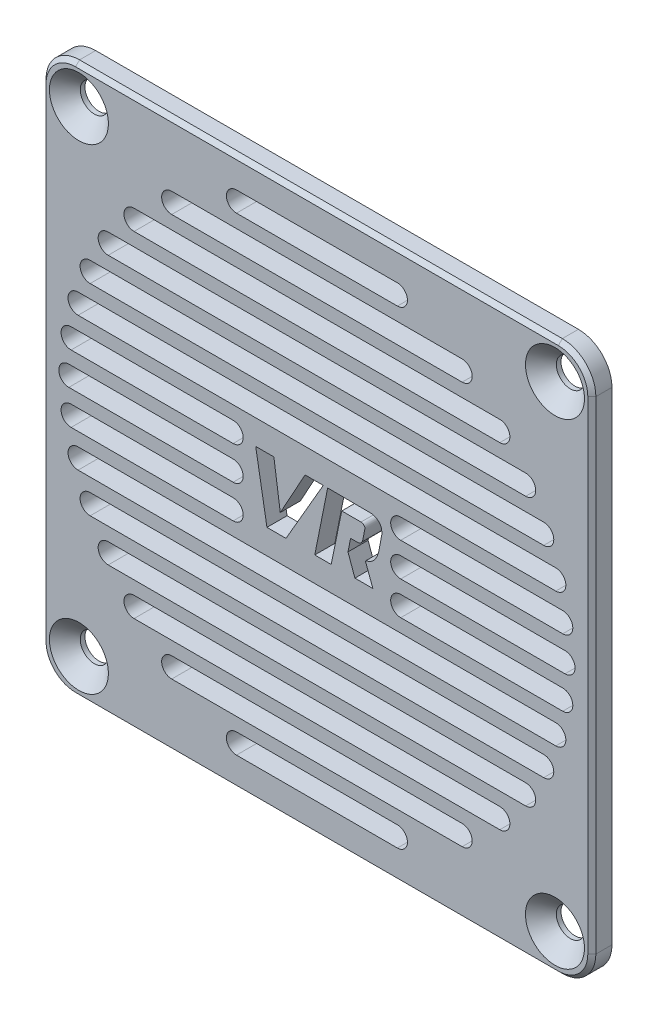
from build123d import *

# Parameters (mm, degrees)
SKETCH1_R     = 2.1
BASE_DEPTH    = 3
CHAMFER1_SIZE = 2.3
LOGO_DEPTH    = 59.060313468
HOLES_DEPTH   = 59.060313614
CHAMFER2_SIZE = 0.6


with BuildPart() as part:
    # Sketch1 → Base (new body)
    with BuildSketch(Plane.XY):
        with BuildLine():
            Line((41, 36), (41, -36))
            ThreePointArc((41, -36), (39.535533906, -39.535533906), (36, -41))
            Line((36, -41), (-36, -41))
            ThreePointArc((-36, -41), (-39.535533906, -39.535533906), (-41, -36))
            Line((-41, -36), (-41, 36))
            ThreePointArc((-41, 36), (-39.535533906, 39.535533906), (-36, 41))
            Line((-36, 41), (36, 41))
            ThreePointArc((36, 41), (39.535533906, 39.535533906), (41, 36))
        make_face()
        with Locations((35.5, -35.5)):
            Circle(SKETCH1_R, mode=Mode.SUBTRACT)
        with Locations((-35.5, -35.5)):
            Circle(SKETCH1_R, mode=Mode.SUBTRACT)
        with Locations((-35.5, 35.5)):
            Circle(SKETCH1_R, mode=Mode.SUBTRACT)
        with Locations((35.5, 35.5)):
            Circle(SKETCH1_R, mode=Mode.SUBTRACT)
    extrude(amount=BASE_DEPTH)

    # Chamfer1
    chamfer1_edges = [part.edges().sort_by_distance(p)[0] for p in [
        (-37.6, -35.5, 3),
        (-37.6, 35.5, 3),
        (33.4, 35.5, 3),
        (33.4, -35.5, 3),
    ]]
    chamfer(chamfer1_edges, length=CHAMFER1_SIZE)

    # Sketch3 → Logo (cut, through all)
    with BuildSketch(Plane.XY.offset(3)):
        Polygon((0.943772225, 4.807339306), (-1.770278146, 4.807339306), (-5.467106691, -1.899839555), (-6.421148406, 4.807339306), (-9.131384374, 4.807339306), (-7.454751896, -4.81111301), (-4.6161142, -4.81111301), align=None)
        with BuildLine():
            Line((3.703527881, 2.889834342), (6.573462709, 2.889834342))
            add(Edge.make_bspline(
                [(6.573462709, 2.889834342), (6.639918683, 2.878954155), (6.706374657, 2.868073967), (6.772830631, 2.857193779), (6.786633549, 2.854933962), (6.814239384, 2.850414328), (6.855551453, 2.832372294), (6.876790416, 2.814167468), (6.887409897, 2.805065055), (6.919492092, 2.777566032), (6.951574286, 2.750067008), (6.983656481, 2.722567984), (6.993167085, 2.714416037), (7.012188295, 2.698112144), (7.038593103, 2.66998605), (7.051500973, 2.648514901), (7.057954908, 2.637779327), (7.075404999, 2.60875258), (7.092855089, 2.579725832), (7.11030518, 2.550699085), (7.116791727, 2.539909264), (7.12976482, 2.518329621), (7.136480315, 2.478226939), (7.136480315, 2.453047938), (7.136480315, 2.440458437), (7.136480315, 2.395991418), (7.136480315, 2.3515244), (7.136480315, 2.307057382), (7.136480315, 2.292302161), (7.136480315, 2.262791718), (7.132234446, 2.218327427), (7.1266495, 2.189350288), (7.123857028, 2.174861718), (7.033719, 1.707186218), (6.943580973, 1.239510717), (6.853442946, 0.771835216), (6.850303902, 0.755548486), (6.844025815, 0.722975025), (6.831361308, 0.674631499), (6.820862573, 0.643163717), (6.815613205, 0.627429826), (6.799830938, 0.580125754), (6.784048672, 0.532821683), (6.768266405, 0.485517611), (6.763799932, 0.472130285), (6.754866986, 0.445355633), (6.73663685, 0.405279323), (6.71826793, 0.383848917), (6.70908347, 0.373133714), (6.685410448, 0.345515187), (6.661737425, 0.317896661), (6.638064403, 0.290278135), (6.630063422, 0.280943658), (6.614061462, 0.262274704), (6.587939681, 0.235980407), (6.569486158, 0.219730482), (6.560259397, 0.21160552), (6.532062416, 0.186775636), (6.503865435, 0.161945752), (6.475668454, 0.137115868), (6.465349713, 0.128029323), (6.44471223, 0.109856232), (6.406036938, 0.091012836), (6.379877632, 0.08253595), (6.366797978, 0.078297507), (6.300222974, 0.05672397), (6.23364797, 0.035150434), (6.167072966, 0.013576897)],
                knots=[0, 0, 0, 0, 0.0565978, 0.0565978, 0.0565978, 0.068353174, 0.080108547, 0.09186392, 0.09186392, 0.09186392, 0.127377722, 0.127377722, 0.127377722, 0.13790561, 0.148433497, 0.158961384, 0.158961384, 0.158961384, 0.18742659, 0.18742659, 0.18742659, 0.198007674, 0.208588759, 0.219169844, 0.219169844, 0.219169844, 0.256542993, 0.256542993, 0.256542993, 0.268944298, 0.281345604, 0.29374691, 0.29374691, 0.29374691, 0.694047762, 0.694047762, 0.694047762, 0.70798818, 0.721928599, 0.735869017, 0.735869017, 0.735869017, 0.777780999, 0.777780999, 0.777780999, 0.789642332, 0.801503665, 0.813364999, 0.813364999, 0.813364999, 0.843937685, 0.843937685, 0.843937685, 0.854270606, 0.864603526, 0.874936447, 0.874936447, 0.874936447, 0.90651385, 0.90651385, 0.90651385, 0.918069663, 0.929625477, 0.94118129, 0.94118129, 0.94118129, 1, 1, 1, 1], degree=3))
            Line((6.167072966, 0.013576897), (5.021039356, 0.013576897))
            Line((5.021039356, 0.013576897), (4.631352863, -1.934855565))
            Line((4.631352863, -1.934855565), (5.663053903, -4.81111301))
            Line((5.663053903, -4.81111301), (8.342652792, -4.81111301))
            Line((8.342652792, -4.81111301), (7.229262814, -1.811145568))
            add(Edge.make_bspline(
                [(9.229165365, 0.414561503), (9.120168623, 0.017200275), (8.915302455, -0.554839168), (8.44639111, -1.160174748), (7.942619292, -1.563122791), (7.499335661, -1.705024341), (7.229262814, -1.811145568)],
                knots=[0, 0, 0, 0, 0.394088826, 0.566272378, 0.72213611, 1, 1, 1, 1], degree=3))
            Line((9.229165365, 0.414561503), (9.678442486, 2.846313591))
            add(Edge.make_bspline(
                [(9.678442486, 2.846313591), (9.687044519, 2.989216011), (9.687308007, 3.219249114), (9.634056055, 3.573555205), (9.530960339, 3.877016599), (9.318991652, 4.174966565), (9.058914286, 4.416757541), (8.748200867, 4.611244982), (8.404818025, 4.732990617), (8.163573675, 4.770595689), (8.033377798, 4.776411806)],
                knots=[0, 0, 0, 0, 0.150297951, 0.240095534, 0.375313148, 0.481557048, 0.620389709, 0.745312315, 0.863340897, 1, 1, 1, 1], degree=3))
            Line((8.033377798, 4.776411806), (1.600457921, 4.807339306))
            Line((1.600457921, 4.807339306), (-0.323232542, -4.81111301))
            Line((-0.323232542, -4.81111301), (2.126225411, -4.81111301))
            Line((2.126225411, -4.81111301), (3.703527881, 2.889834342))
        make_face()
    extrude(amount=-LOGO_DEPTH, mode=Mode.SUBTRACT)

    # Sketch4 → Holes (cut, through all)
    with BuildSketch(Plane.XY.offset(3)):
        with BuildLine():
            Line((-33.823069051, 16.5), (33.823069051, 16.5))
            ThreePointArc((33.823069051, 16.5), (35.323069051, 15), (33.823069051, 13.5))
            Line((33.823069051, 13.5), (-33.823069051, 13.5))
            ThreePointArc((-33.823069051, 13.5), (-35.323069051, 15), (-33.823069051, 16.5))
        make_face()
        with BuildLine():
            Line((-35.623026261, 11.5), (35.623026261, 11.5))
            ThreePointArc((35.623026261, 11.5), (37.123026261, 10), (35.623026261, 8.5))
            Line((35.623026261, 8.5), (-35.623026261, 8.5))
            ThreePointArc((-35.623026261, 8.5), (-37.123026261, 10), (-35.623026261, 11.5))
        make_face()
        with BuildLine():
            Line((-33.823069051, -13.5), (33.823069051, -13.5))
            ThreePointArc((33.823069051, -13.5), (35.323069051, -15), (33.823069051, -16.5))
            Line((33.823069051, -16.5), (-33.823069051, -16.5))
            ThreePointArc((-33.823069051, -16.5), (-35.323069051, -15), (-33.823069051, -13.5))
        make_face()
        with BuildLine():
            Line((-35.623026261, -8.5), (35.623026261, -8.5))
            ThreePointArc((35.623026261, -8.5), (37.123026261, -10), (35.623026261, -11.5))
            Line((35.623026261, -11.5), (-35.623026261, -11.5))
            ThreePointArc((-35.623026261, -11.5), (-37.123026261, -10), (-35.623026261, -8.5))
        make_face()
        with BuildLine():
            Line((12.5, 6.5), (36.66060556, 6.5))
            ThreePointArc((36.66060556, 6.5), (38.16060556, 5), (36.66060556, 3.5))
            Line((36.66060556, 3.5), (12.5, 3.5))
            ThreePointArc((12.5, 3.5), (11, 5), (12.5, 6.5))
        make_face()
        with BuildLine():
            Line((12.5, -3.5), (36.66060556, -3.5))
            ThreePointArc((36.66060556, -3.5), (38.16060556, -5), (36.66060556, -6.5))
            Line((36.66060556, -6.5), (12.5, -6.5))
            ThreePointArc((12.5, -6.5), (11, -5), (12.5, -3.5))
        make_face()
        with BuildLine():
            Line((-36.66060556, 6.5), (-12.5, 6.5))
            ThreePointArc((-12.5, 6.5), (-11, 5), (-12.5, 3.5))
            Line((-12.5, 3.5), (-36.66060556, 3.5))
            ThreePointArc((-36.66060556, 3.5), (-38.16060556, 5), (-36.66060556, 6.5))
        make_face()
        with BuildLine():
            Line((-36.66060556, -3.5), (-12.5, -3.5))
            ThreePointArc((-12.5, -3.5), (-11, -5), (-12.5, -6.5))
            Line((-12.5, -6.5), (-36.66060556, -6.5))
            ThreePointArc((-36.66060556, -6.5), (-38.16060556, -5), (-36.66060556, -3.5))
        make_face()
        with BuildLine():
            Line((-37, 1.5), (-12.5, 1.5))
            ThreePointArc((-12.5, 1.5), (-11, 0), (-12.5, -1.5))
            Line((-12.5, -1.5), (-37, -1.5))
            ThreePointArc((-37, -1.5), (-38.5, 0), (-37, 1.5))
        make_face()
        with BuildLine():
            Line((12.5, 1.5), (37, 1.5))
            ThreePointArc((37, 1.5), (38.5, 0), (37, -1.5))
            Line((37, -1.5), (12.5, -1.5))
            ThreePointArc((12.5, -1.5), (11, 0), (12.5, 1.5))
        make_face()
        with BuildLine():
            Line((-31.128764833, 21.5), (31.128764833, 21.5))
            ThreePointArc((31.128764833, 21.5), (32.628764833, 20), (31.128764833, 18.5))
            Line((31.128764833, 18.5), (-31.128764833, 18.5))
            ThreePointArc((-31.128764833, 18.5), (-32.628764833, 20), (-31.128764833, 21.5))
        make_face()
        with BuildLine():
            Line((-27.276363394, 26.5), (27.276363394, 26.5))
            ThreePointArc((27.276363394, 26.5), (28.776363394, 25), (27.276363394, 23.5))
            Line((27.276363394, 23.5), (-27.276363394, 23.5))
            ThreePointArc((-27.276363394, 23.5), (-28.776363394, 25), (-27.276363394, 26.5))
        make_face()
        with BuildLine():
            Line((-21.656407828, 31.5), (21.656407828, 31.5))
            ThreePointArc((21.656407828, 31.5), (23.156407828, 30), (21.656407828, 28.5))
            Line((21.656407828, 28.5), (-21.656407828, 28.5))
            ThreePointArc((-21.656407828, 28.5), (-23.156407828, 30), (-21.656407828, 31.5))
        make_face()
        with BuildLine():
            Line((-12, 36.5), (12, 36.5))
            ThreePointArc((12, 36.5), (13.5, 35), (12, 33.5))
            Line((12, 33.5), (-12, 33.5))
            ThreePointArc((-12, 33.5), (-13.5, 35), (-12, 36.5))
        make_face()
        with BuildLine():
            Line((-31.128764833, -21.5), (31.128764833, -21.5))
            ThreePointArc((31.128764833, -21.5), (32.628764833, -20), (31.128764833, -18.5))
            Line((31.128764833, -18.5), (-31.128764833, -18.5))
            ThreePointArc((-31.128764833, -18.5), (-32.628764833, -20), (-31.128764833, -21.5))
        make_face()
        with BuildLine():
            Line((-27.276363394, -26.5), (27.276363394, -26.5))
            ThreePointArc((27.276363394, -26.5), (28.776363394, -25), (27.276363394, -23.5))
            Line((27.276363394, -23.5), (-27.276363394, -23.5))
            ThreePointArc((-27.276363394, -23.5), (-28.776363394, -25), (-27.276363394, -26.5))
        make_face()
        with BuildLine():
            Line((-21.656407828, -31.5), (21.656407828, -31.5))
            ThreePointArc((21.656407828, -31.5), (23.156407828, -30), (21.656407828, -28.5))
            Line((21.656407828, -28.5), (-21.656407828, -28.5))
            ThreePointArc((-21.656407828, -28.5), (-23.156407828, -30), (-21.656407828, -31.5))
        make_face()
        with BuildLine():
            Line((-12, -36.5), (12, -36.5))
            ThreePointArc((12, -36.5), (13.5, -35), (12, -33.5))
            Line((12, -33.5), (-12, -33.5))
            ThreePointArc((-12, -33.5), (-13.5, -35), (-12, -36.5))
        make_face()
    extrude(amount=-HOLES_DEPTH, mode=Mode.SUBTRACT)

    # Chamfer2
    chamfer2_edges = [part.edges().sort_by_distance(p)[0] for p in [
        (0, 41, 3),
        (-39.535533906, 39.535533906, 3),
        (-41, 0, 3),
        (-39.535533906, -39.535533906, 3),
        (0, -41, 3),
        (39.535533906, -39.535533906, 3),
        (41, 0, 3),
        (39.535533906, 39.535533906, 3),
    ]]
    chamfer(chamfer2_edges, length=CHAMFER2_SIZE)


solid = part.part
